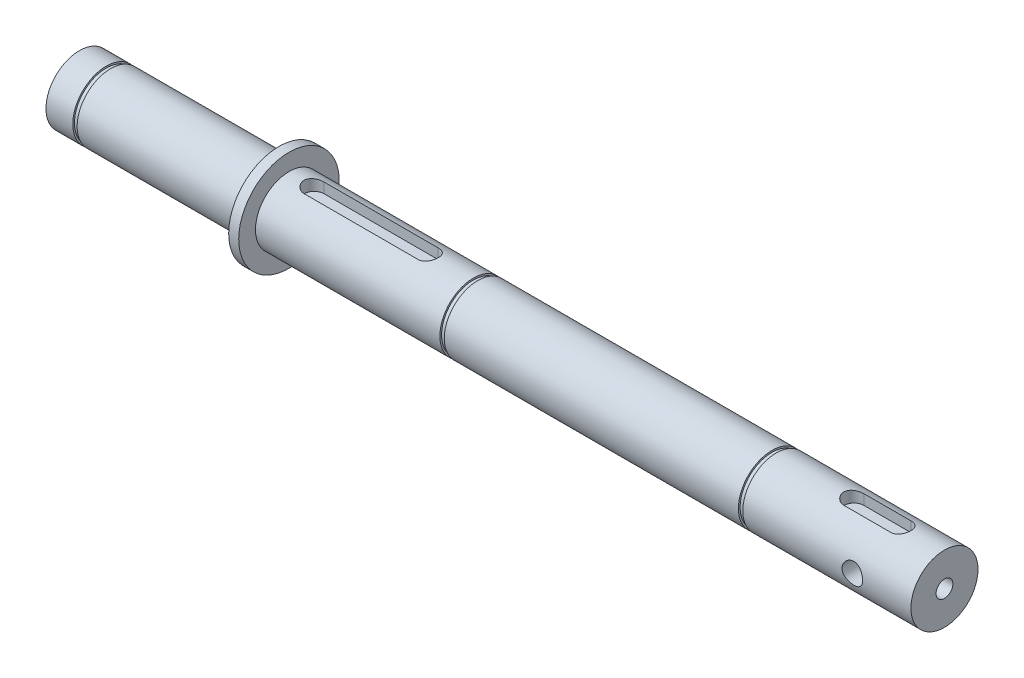
from build123d import *

# Parameters (mm, degrees)
SALIENTE_EXTRUIR1_START                = 8
CROQUIS1_R                             = 10
SALIENTE_EXTRUIR1_DEPTH                = 258
CROQUIS2_R                             = 15
SALIENTE_EXTRUIR2_DEPTH                = 3
CORTAR_EXTRUIR1_REACH                  = 268.845
CORTAR_EXTRUIR1_END_RADIUS             = 10
CROQUIS3_R                             = 3.075
CORTAR_EXTRUIR1_DIRECTION_2_REACH      = 268.845
CORTAR_EXTRUIR1_DIRECTION_2_END_RADIUS = 10
CORTAR_EXTRUIR2_START                  = 10
CORTAR_EXTRUIR2_DEPTH                  = 3.5
TALADRO_ROSCADO_M61_D                  = 5
TALADRO_ROSCADO_M61_DEPTH              = 11.497848452
TALADRO_ROSCADO_M61_TIP                = 1.502151548
CORTAR_EXTRUIR3_START                  = 10
CORTAR_EXTRUIR3_DEPTH                  = 3.5
CORTAR_EXTRUIR4_START                  = 125.5
CROQUIS9_R                             = 10
CROQUIS9_R_2                           = 9.5
CORTAR_EXTRUIR4_DEPTH                  = 1.3
CORTAR_EXTRUIR5_START                  = 214.543146
CROQUIS10_R                            = 10
CROQUIS10_R_2                          = 9.5
CORTAR_EXTRUIR5_DEPTH                  = 1.3
CORTAR_EXTRUIR6_START                  = -8
CROQUIS11_R                            = 10
CROQUIS11_R_2                          = 9.5
CORTAR_EXTRUIR6_DEPTH                  = 1.3


with BuildPart() as part:
    # Croquis1 → Saliente-Extruir1 (new body)
    with BuildSketch(Plane(origin=(0, 0, 0), x_dir=(0, 0, -1), z_dir=(1, 0, 0)).offset(SALIENTE_EXTRUIR1_START)):
        Circle(CROQUIS1_R)
    extrude(amount=SALIENTE_EXTRUIR1_DEPTH)

    # Croquis2 → Saliente-Extruir2 (add)
    with BuildSketch(Plane.ZY.offset(-70.5)):
        Circle(CROQUIS2_R)
    extrude(amount=SALIENTE_EXTRUIR2_DEPTH)

    # Cortar-Extruir1: up to this cylinder (the profile starts inside it)
    cortar_extruir1_end = Plane(origin=(248.5, 0, 0), z_dir=(-1, 0, 0)) * Cylinder(CORTAR_EXTRUIR1_END_RADIUS, 558.69, mode=Mode.PRIVATE)
    # Croquis3 → Cortar-Extruir1 (cut, up to the surface)
    with BuildSketch(Plane.XY, mode=Mode.PRIVATE) as cortar_extruir1_sk1:
        with Locations((248.5, 0)):
            Circle(CROQUIS3_R)
    cortar_extruir1_tool1 = extrude(cortar_extruir1_sk1.sketch, amount=-CORTAR_EXTRUIR1_REACH, mode=Mode.PRIVATE) & cortar_extruir1_end
    add(cortar_extruir1_tool1.solids().sort_by_distance((248.5, 0, 0))[0], mode=Mode.SUBTRACT)

    # Cortar-Extruir1 direction 2: up to this cylinder (the profile starts inside it)
    cortar_extruir1_direction_2_end = Plane(origin=(248.5, 0, 0), z_dir=(-1, 0, 0)) * Cylinder(CORTAR_EXTRUIR1_DIRECTION_2_END_RADIUS, 558.69, mode=Mode.PRIVATE)
    # Croquis3 → Cortar-Extruir1 direction 2 (cut, up to the surface)
    with BuildSketch(Plane.XY, mode=Mode.PRIVATE) as cortar_extruir1_direction_2_sk1:
        with Locations((248.5, 0)):
            Circle(CROQUIS3_R)
    cortar_extruir1_direction_2_tool1 = extrude(cortar_extruir1_direction_2_sk1.sketch, amount=CORTAR_EXTRUIR1_DIRECTION_2_REACH, mode=Mode.PRIVATE) & cortar_extruir1_direction_2_end
    add(cortar_extruir1_direction_2_tool1.solids().sort_by_distance((248.5, 0, 0))[0], mode=Mode.SUBTRACT)

    # Croquis4 → Cortar-Extruir2 (cut)
    with BuildSketch(Plane(origin=(0, 0, 0), x_dir=(1, 0, 0), z_dir=(0, 1, 0)).offset(CORTAR_EXTRUIR2_START)):
        with BuildLine():
            Line((239, 3), (253, 3))
            ThreePointArc((253, 3), (256, 0), (253, -3))
            Line((253, -3), (239, -3))
            ThreePointArc((239, -3), (236, 0), (239, 3))
        make_face()
    extrude(amount=-CORTAR_EXTRUIR2_DEPTH, mode=Mode.SUBTRACT)

    # Taladro roscado M61
    with Locations(Plane(origin=(266, 0, 0), x_dir=(0, 0, 1), z_dir=(1, 0, 0))):
        with Locations((0, 0)):
            Hole(TALADRO_ROSCADO_M61_D / 2, depth=TALADRO_ROSCADO_M61_DEPTH)
            with Locations((0, 0, -(TALADRO_ROSCADO_M61_DEPTH + TALADRO_ROSCADO_M61_TIP / 2))):  # 118° drill point
                Cone(0, TALADRO_ROSCADO_M61_D / 2, TALADRO_ROSCADO_M61_TIP, mode=Mode.SUBTRACT)

    # Croquis8 → Cortar-Extruir3 (cut)
    with BuildSketch(Plane(origin=(0, 0, 0), x_dir=(1, 0, 0), z_dir=(0, 1, 0)).offset(CORTAR_EXTRUIR3_START)):
        with BuildLine():
            Line((78, 3), (112, 3))
            ThreePointArc((112, 3), (115, 0), (112, -3))
            Line((112, -3), (78, -3))
            ThreePointArc((78, -3), (75, 0), (78, 3))
        make_face()
    extrude(amount=-CORTAR_EXTRUIR3_DEPTH, mode=Mode.SUBTRACT)

    # Croquis9 → Cortar-Extruir4 (cut)
    with BuildSketch(Plane(origin=(0, 0, 0), x_dir=(0, 0, -1), z_dir=(1, 0, 0)).offset(CORTAR_EXTRUIR4_START)):
        with Locations(Location((0, 0, 0), (0, 0, 180))):
            Circle(CROQUIS9_R)
        Circle(CROQUIS9_R_2, mode=Mode.SUBTRACT)
    extrude(amount=CORTAR_EXTRUIR4_DEPTH, mode=Mode.SUBTRACT)

    # Croquis10 → Cortar-Extruir5 (cut)
    with BuildSketch(Plane(origin=(0, 0, 0), x_dir=(0, 0, -1), z_dir=(1, 0, 0)).offset(CORTAR_EXTRUIR5_START)):
        with Locations(Location((0, 0, 0), (0, 0, 180))):
            Circle(CROQUIS10_R)
        Circle(CROQUIS10_R_2, mode=Mode.SUBTRACT)
    extrude(amount=CORTAR_EXTRUIR5_DEPTH, mode=Mode.SUBTRACT)

    # Croquis11 → Cortar-Extruir6 (cut)
    with BuildSketch(Plane.ZY.offset(-8).offset(CORTAR_EXTRUIR6_START)):
        Circle(CROQUIS11_R)
        with Locations(Location((0, 0, 0), (0, 0, 180))):
            Circle(CROQUIS11_R_2, mode=Mode.SUBTRACT)
    extrude(amount=-CORTAR_EXTRUIR6_DEPTH, mode=Mode.SUBTRACT)


solid = part.part
